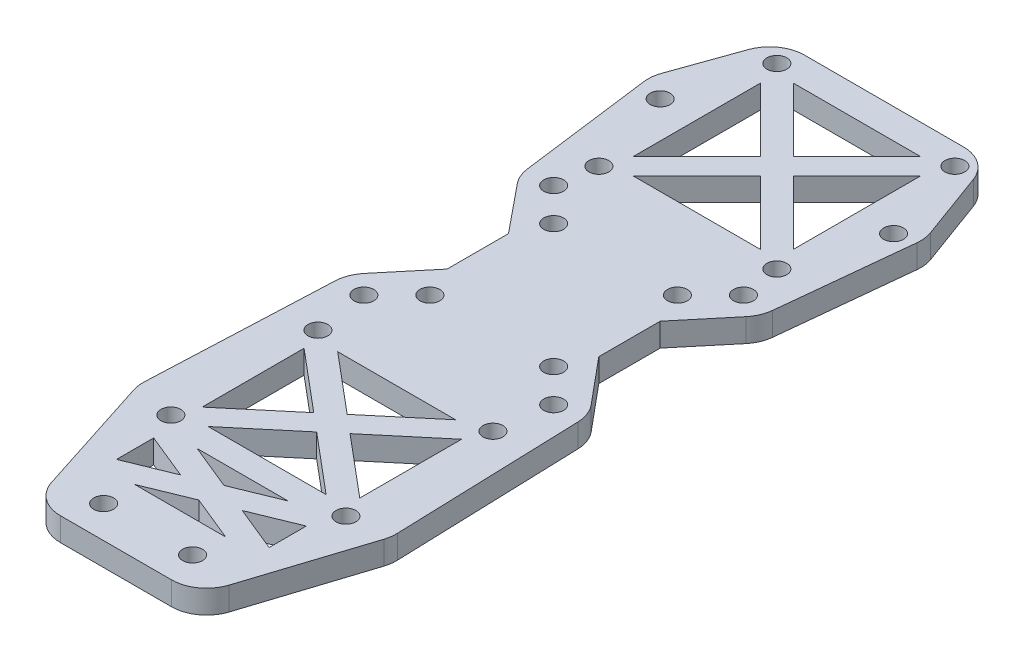
from build123d import *

# Parameters (mm, degrees)
BOSS_EXTRUDE1_DEPTH  = 4
CUT_EXTRUDE1_DEPTH   = 10
M3_CLEARANCE_HOLE3_D = 3.4
M3_CLEARANCE_HOLE4_D = 3.4


with BuildPart() as part:
    # Sketch1 → Boss-Extrude1 (new body)
    with BuildSketch(Plane(origin=(0, 0, 0), x_dir=(1, 0, 0), z_dir=(0, 1, 0))):
        with BuildLine():
            Line((-9.515488572, -74.994808418), (9.515488572, -74.994808418))
            ThreePointArc((9.515488572, -74.994808418), (13.049333225, -73.843719838), (15.227255138, -70.832122406))
            Line((15.227255138, -70.832122406), (21.674585029, -50.788926983))
            ThreePointArc((21.674585029, -50.788926983), (21.904821248, -49.783840665), (21.959569126, -48.754175722))
            Line((21.959569126, -48.754175722), (20.905492982, -16.738783097))
            ThreePointArc((20.905492982, -16.738783097), (20.516685602, -14.802919609), (19.520547525, -13.098088957))
            Line((19.520547525, -13.098088957), (13, -5.263157895))
            Line((13, -5.263157895), (13, 5.263157895))
            Line((13, 5.263157895), (19.670378922, 13.278122714))
            ThreePointArc((19.670378922, 13.278122714), (20.587655893, 14.78617896), (21.026416806, 16.495892253))
            Line((21.026416806, 16.495892253), (23.354507229, 38.891979018))
            ThreePointArc((23.354507229, 38.891979018), (23.340591043, 40.254469199), (23.019622055, 41.578686728))
            Line((23.019622055, 41.578686728), (18.764127525, 53.179369038))
            ThreePointArc((18.764127525, 53.179369038), (16.566422509, 56.032274923), (13.131169609, 57.113023201))
            Line((13.131169609, 57.113023201), (-14.108422678, 57.113023201))
            ThreePointArc((-14.108422678, 57.113023201), (-17.566572488, 56.016205829), (-19.760402704, 53.126756496))
            Line((-19.760402704, 53.126756496), (-23.659003651, 42.184485876))
            ThreePointArc((-23.659003651, 42.184485876), (-23.973087581, 40.807997325), (-23.956822357, 39.396223658))
            Line((-23.956822357, 39.396223658), (-20.971772171, 16.465578606))
            ThreePointArc((-20.971772171, 16.465578606), (-20.532623688, 14.866769408), (-19.672669362, 13.44919373))
            Line((-19.672669362, 13.44919373), (-13, 5.263157895))
            Line((-13, 5.263157895), (-13, -5.263157895))
            Line((-13, -5.263157895), (-19.456827239, -13.021524214))
            ThreePointArc((-19.456827239, -13.021524214), (-20.441610734, -14.696742104), (-20.839350394, -16.598834814))
            Line((-20.839350394, -16.598834814), (-22.202521241, -47.927982232))
            ThreePointArc((-22.202521241, -47.927982232), (-22.154511659, -48.989610746), (-21.919959446, -50.026117032))
            Line((-21.919959446, -50.026117032), (-15.227255138, -70.832122406))
            ThreePointArc((-15.227255138, -70.832122406), (-13.049333225, -73.843719838), (-9.515488572, -74.994808418))
        make_face()
    extrude(amount=BOSS_EXTRUDE1_DEPTH)

    # Sketch6 → Cut-Extrude1 (cut)
    with BuildSketch(Plane(origin=(0, 4, 0), x_dir=(1, 0, 0), z_dir=(0, 1, 0))):
        Polygon((0, 35.421572875), (-10.921572875, 24.5), (10.921572875, 24.5), align=None)
        Polygon((7.79159133, -53.303689334), (-7.79159133, -53.303689334), (0, -56.489348074), align=None)
        Polygon((-5.284733567, -58.650056583), (-13.076324897, -55.464397842), (-13.076324897, -61.835715323), align=None)
        Polygon((2.828427125, 38.25), (13.75, 27.328427125), (13.75, 49.171572875), align=None)
        Polygon((-3.109490994, -38), (-13.5, -29.271972435), (-13.5, -46.728027565), align=None)
        Polygon((0, -40.611972435), (-10.104794721, -49.1), (10.104794721, -49.1), align=None)
        Polygon((0, -60.810765091), (-7.79159133, -63.996423832), (7.79159133, -63.996423832), align=None)
        Polygon((-13.75, 49.171572875), (-13.75, 27.328427125), (-2.828427125, 38.25), align=None)
        Polygon((13.076324897, -61.835715323), (13.076324897, -55.464397842), (5.284733567, -58.650056583), align=None)
        Polygon((-10.921572875, 52), (0, 41.078427125), (10.921572875, 52), align=None)
        Polygon((10.104794721, -26.9), (-10.104794721, -26.9), (0, -35.388027565), align=None)
        Polygon((13.5, -29.271972435), (3.109490994, -38), (13.5, -46.728027565), align=None)
    extrude(amount=-CUT_EXTRUDE1_DEPTH, mode=Mode.SUBTRACT)

    # M3 Clearance Hole3 (through all)
    with Locations(Plane(origin=(0, 4, 0), x_dir=(1, 0, 0), z_dir=(0, 1, 0))):
        with Locations((7.62, -69.497474683), (-7.62, -69.497474683), (-26.177409906, -26.177409906), (26.177409906, -26.177409906), (26.177409906, 26.177409906), (-26.177409906, 26.177409906), (-15, -25.4), (-15.25, 23), (-15.25, 53.5), (15.25, 53.5), (15.25, 23), (-15, -50.6), (15, -50.6), (15, -25.4), (20, 38.25), (-20, 38.25)):
            Hole(M3_CLEARANCE_HOLE3_D / 2)

    # M3 Clearance Hole4 (through all)
    with Locations(Plane(origin=(0, 4, 0), x_dir=(1, 0, 0), z_dir=(0, 1, 0))):
        with Locations((-10.606601718, 10.606601718), (-16.263455967, 16.263455967), (10.606601718, 10.606601718), (16.263455967, 16.263455967), (16.263455967, -16.263455967), (10.606601718, -10.606601718), (-10.606601718, -10.606601718), (-16.263455967, -16.263455967)):
            Hole(M3_CLEARANCE_HOLE4_D / 2)


solid = part.part
